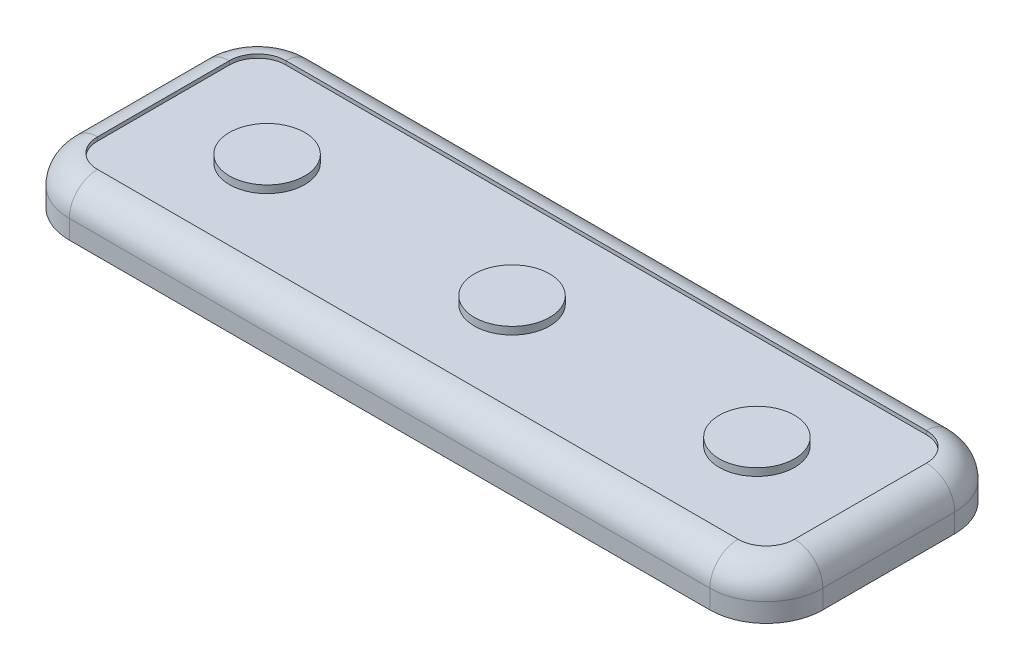
from build123d import *

# Parameters (mm, degrees)
SKETCH1_W               = 10160
SKETCH1_H               = 3302
BOSS_EXTRUDE1_DEPTH     = 635
FILLET1_R               = 762
FILLET2_R               = 381
SHELL1_T                = -101.6
CUT_EXTRUDE1_DEPTH      = 10109.2
CUT_EXTRUDE1_DEPTH_BACK = 50.8
SKETCH3_R               = 127
CUT_EXTRUDE2_DEPTH      = 50.8
SKETCH5_R               = 508
BOSS_EXTRUDE2_DEPTH     = 101.6


with BuildPart() as part:
    # Sketch1 → Boss-Extrude1 (new body)
    with BuildSketch(Plane(origin=(0, 0, 0), x_dir=(1, 0, 0), z_dir=(0, 1, 0))):
        Rectangle(SKETCH1_W, SKETCH1_H)
    extrude(amount=BOSS_EXTRUDE1_DEPTH)

    # Fillet1
    fillet1_edges = [part.edges().sort_by_distance(p)[0] for p in [
        (5080, 317.5, 1651),
        (-5080, 317.5, 1651),
        (-5080, 317.5, -1651),
        (5080, 317.5, -1651),
    ]]
    fillet(fillet1_edges, radius=FILLET1_R)

    # Fillet2
    fillet2_edges = [part.edges().sort_by_distance(p)[0] for p in [
        (-5080, 635, 0),
        (0, 635, -1651),
        (5080, 635, 0),
        (0, 635, 1651),
        (-4856.815367264, 635, 1427.815367264),
        (4856.815367264, 635, 1427.815367264),
        (4856.815367264, 635, -1427.815367264),
        (-4856.815367264, 635, -1427.815367264),
    ]]
    fillet(fillet2_edges, radius=FILLET2_R)

    # Shell1
    shell1_openings = [part.faces().sort_by_distance(p)[0] for p in [
        (0, 0, 0),
    ]]
    offset(amount=SHELL1_T, openings=shell1_openings, kind=Kind.INTERSECTION)

    # Sketch3 → Cut-Extrude1 (cut, two sides: drawn at the far end of the back side and taken through both)
    with BuildSketch(Plane.ZY.offset(-4978.4).offset(-CUT_EXTRUDE1_DEPTH_BACK)):
        with Locations((635, 0)):
            Circle(SKETCH3_R)
        with Locations((-635, 0)):
            Circle(SKETCH3_R)
    extrude(amount=CUT_EXTRUDE1_DEPTH + CUT_EXTRUDE1_DEPTH_BACK, mode=Mode.SUBTRACT)

    # Sketch4 → Cut-Extrude2 (cut)
    with BuildSketch(Plane(origin=(0, 635, 0), x_dir=(1, 0, 0), z_dir=(0, 1, 0))):
        with BuildLine():
            Line((4699, -889), (4699, 889))
            ThreePointArc((4699, 889), (4587.407683632, 1158.407683632), (4318, 1270))
            Line((4318, 1270), (-4318, 1270))
            ThreePointArc((-4318, 1270), (-4587.407683632, 1158.407683632), (-4699, 889))
            Line((-4699, 889), (-4699, -889))
            ThreePointArc((-4699, -889), (-4587.407683632, -1158.407683632), (-4318, -1270))
            Line((-4318, -1270), (4318, -1270))
            ThreePointArc((4318, -1270), (4587.407683632, -1158.407683632), (4699, -889))
        make_face()
    extrude(amount=-CUT_EXTRUDE2_DEPTH, mode=Mode.SUBTRACT)

    # Sketch5 → Boss-Extrude2 (add)
    with BuildSketch(Plane(origin=(0, 584.2, 0), x_dir=(1, 0, 0), z_dir=(0, 1, 0))):
        with Locations(Location((0, 0, 0), (0, 0, 270))):
            Circle(SKETCH5_R)
        with Locations(Location((3302, 0, 0), (0, 0, 270))):
            Circle(SKETCH5_R)
        with Locations(Location((-3302, 0, 0), (0, 0, 270))):
            Circle(SKETCH5_R)
    extrude(amount=BOSS_EXTRUDE2_DEPTH)


solid = part.part
